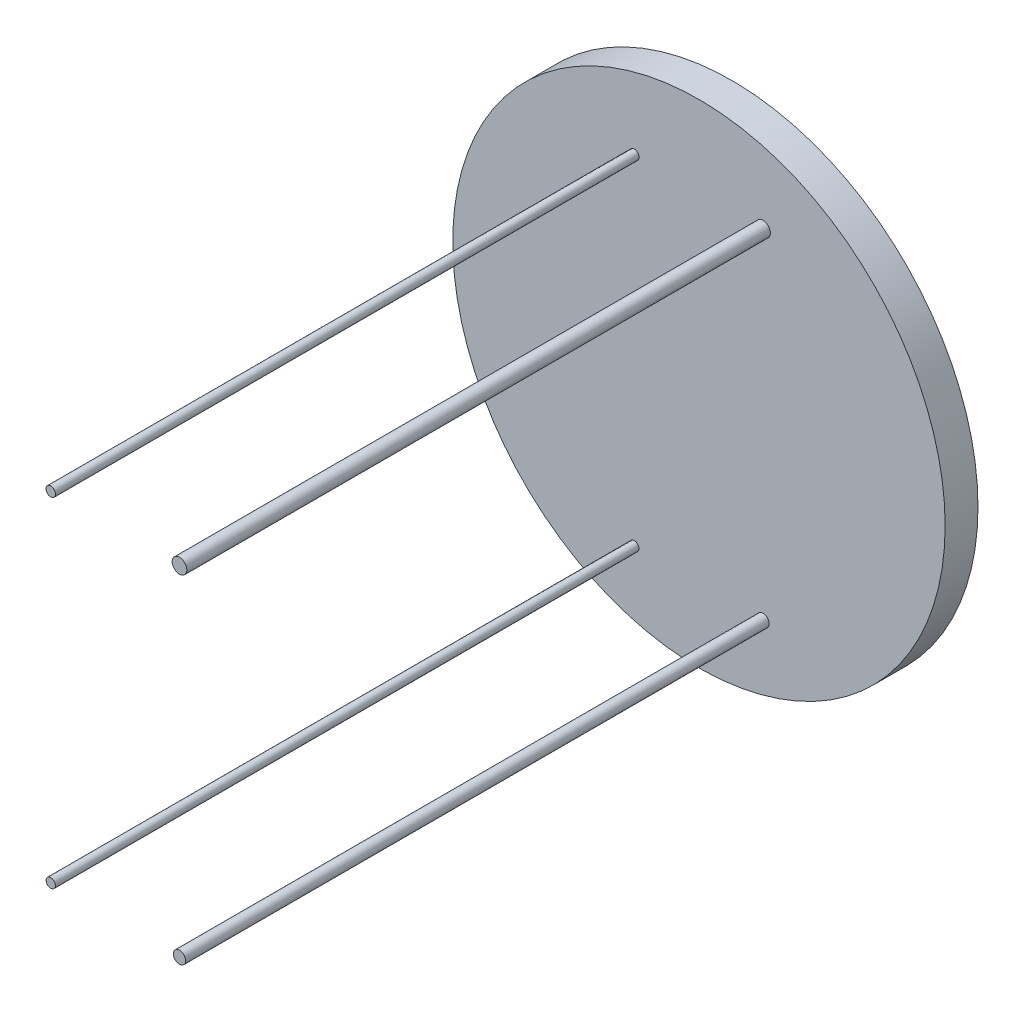
from build123d import *

# Parameters (mm, degrees)
SKETCH1_R           = 1304.092779863
BOSS_EXTRUDE1_DEPTH = 174
SKETCH3_R           = 38.771715285
SKETCH3_R_2         = 25.192981172
SKETCH3_R_3         = 24.521075722
SKETCH3_R_4         = 32.254492843
BOSS_EXTRUDE2_DEPTH = 3091


with BuildPart() as part:
    # Sketch1 → Boss-Extrude1 (new body)
    with BuildSketch(Plane.XY.offset(943.510776168)):
        with Locations((833.930631376, -1197.16637306)):
            Circle(SKETCH1_R)
    extrude(amount=-BOSS_EXTRUDE1_DEPTH)

    # Sketch3 → Boss-Extrude2 (add)
    with BuildSketch(Plane.XY.offset(943.510776168)):
        with Locations((1173.639225527, -317.201613393)):
            Circle(SKETCH3_R)
        with Locations((491.765116758, -317.201613393)):
            Circle(SKETCH3_R_2)
        with Locations((491.765116758, -2112.860849235)):
            Circle(SKETCH3_R_3)
        with Locations((1173.639225527, -2112.860849235)):
            Circle(SKETCH3_R_4)
    extrude(amount=BOSS_EXTRUDE2_DEPTH)


solid = part.part
